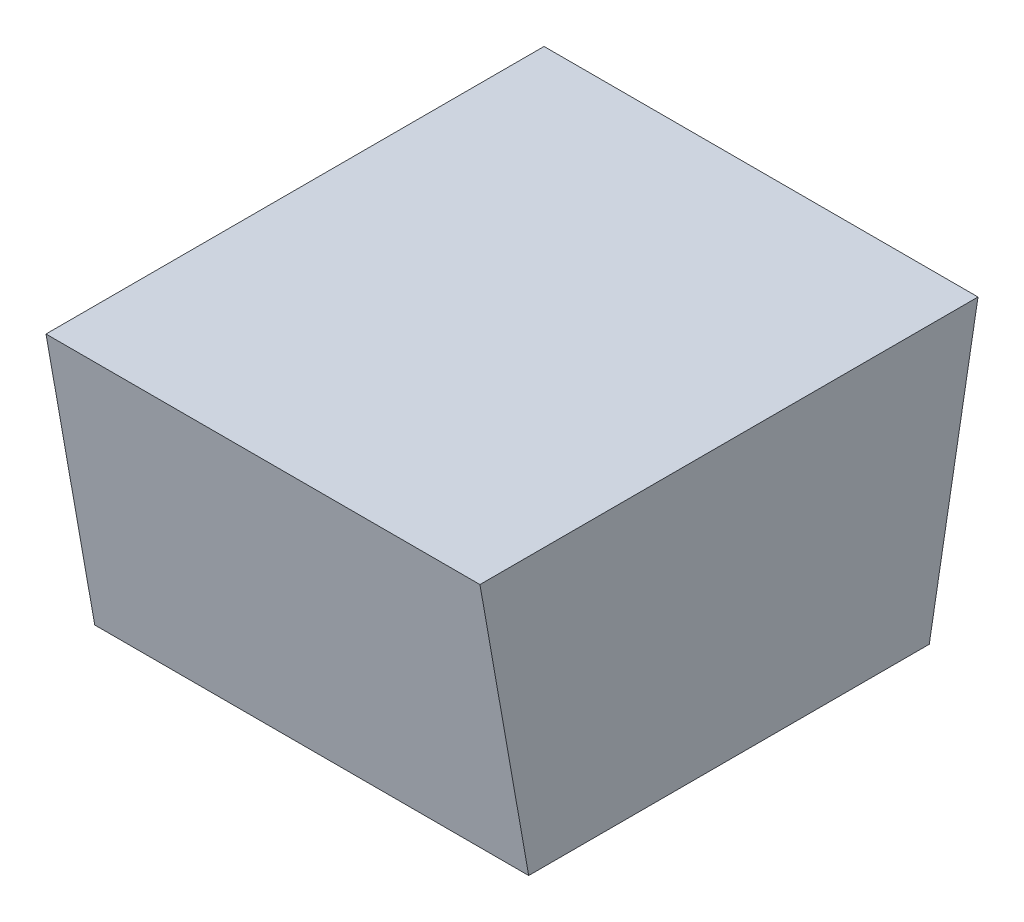
from build123d import *

# Parameters (mm, degrees)
SKETCH_TL_CUTTING_R    = 1.498500051
TL_CUTTING_DEPTH       = 29.999999944
SKETCH_TDF_CUTTING_W   = 3.017000062
SKETCH_TDF_CUTTING_H   = 3.017000062
TDF_CUTTING_DEPTH      = 31.074756881
VW_VR_GRINDING_DEPTH   = 1.508500031
VW_VR_GRINDING_2_DEPTH = 1.508500031
ISA_GRINDING_DEPTH     = 1.508500031
SKETCH_PRE_FRX_BRX_W   = 1.16299996
SKETCH_PRE_FRX_BRX_H   = 0.889999998
SKETCH_PRE_FRX_BRX_W_2 = 1.194000152
PRE_FRX_BRX_DEPTH      = 1.508500031
FA_BA_GRINDING_DEPTH   = 1.508500031


with BuildPart() as part:
    # sketch_TL_cutting → TL_cutting (new body)
    with BuildSketch(Plane(origin=(0, 0, 0), x_dir=(1, 0, 0), z_dir=(0, 1, 0))):
        with Locations(Location((0, 0, 0), (0, 0, 270))):
            Circle(SKETCH_TL_CUTTING_R)
    extrude(amount=TL_CUTTING_DEPTH)

    # sketch_TDF_cutting → TDF_cutting (cut, through all)
    with BuildSketch(Plane(origin=(0, 0, 0), x_dir=(1, 0, 0), z_dir=(0, 1, 0))):
        with Locations((-2.709999914, 0)):
            Rectangle(SKETCH_TDF_CUTTING_W, SKETCH_TDF_CUTTING_H)
    extrude(amount=TDF_CUTTING_DEPTH, mode=Mode.SUBTRACT)


with BuildPart() as body_2:
    # sketch_VW_VR_grinding → VW_VR_grinding (new, symmetric)
    with BuildSketch(Plane(origin=(0, 0, 0), x_dir=(0, 0, -1), z_dir=(1, 0, 0))):
        with BuildLine():
            Line((-1.493500061, -0.00999998), (-1.493500061, 0.878888912))
            ThreePointArc((-1.493500061, 0.878888912), (-1.493548388, 0.87999579), (-1.493693003, 0.881094244))
            Line((-1.493693003, 0.881094244), (-1.518500011, 1.02178178))
            Line((-1.518500011, 1.02178178), (-1.508500031, -0.00999998))
            Line((-1.508500031, -0.00999998), (-1.493500061, -0.00999998))
        make_face()
    extrude(amount=VW_VR_GRINDING_DEPTH, both=True)


with BuildPart() as body_3:
    # sketch_VW_VR_grinding → VW_VR_grinding 2 (new, symmetric)
    with BuildSketch(Plane(origin=(0, 0, 0), x_dir=(0, 0, -1), z_dir=(1, 0, 0))):
        with BuildLine():
            Line((1.493500061, -0.00999998), (1.493500061, 0.878888912))
            ThreePointArc((1.493500061, 0.878888912), (1.493548388, 0.87999579), (1.493693003, 0.881094244))
            Line((1.493693003, 0.881094244), (1.518500011, 1.02178178))
            Line((1.518500011, 1.02178178), (1.508500031, -0.00999998))
            Line((1.508500031, -0.00999998), (1.493500061, -0.00999998))
        make_face()
    extrude(amount=VW_VR_GRINDING_2_DEPTH, both=True)


    add(body_2.part)  # ISA_grinding merges body 2
    # sketch_ISA_grinding → ISA_grinding (add, symmetric)
    with BuildSketch(Plane(origin=(0, 0, 0), x_dir=(0, 0, -1), z_dir=(1, 0, 0))):
        Polygon((-0.300000035, 0), (0.300000035, 0), (1.508500031, 6.853744056), (1.508500031, -0.02999994), (-1.508500031, -0.02999994), (-1.508500031, 6.853744056), align=None)
    extrude(amount=ISA_GRINDING_DEPTH, both=True)

    # sketch_pre_FRX_BRX → pre_FRX_BRX (add, symmetric)
    with BuildSketch(Plane.XY):
        with Locations((0.917000071, 0.435000019)):
            Rectangle(SKETCH_PRE_FRX_BRX_W, SKETCH_PRE_FRX_BRX_H)
        with Locations((-0.921499935, 0.435000019)):
            Rectangle(SKETCH_PRE_FRX_BRX_W_2, SKETCH_PRE_FRX_BRX_H)
    extrude(amount=PRE_FRX_BRX_DEPTH, both=True)

    # sketch_FA_BA_grinding → FA_BA_grinding (add, symmetric)
    with BuildSketch(Plane.XY):
        Polygon((0.325500111, -0.00999998), (0.325500111, 0.889999998), (1.625500051, 10.13998021), (1.625500051, -0.00999998), align=None)
        Polygon((-0.324499859, -0.00999998), (-0.324499859, 0.889999998), (-1.328499883, 8.03383137), (-1.328499883, -0.00999998), align=None)
    extrude(amount=FA_BA_GRINDING_DEPTH, both=True)


with BuildPart() as part_1:
    add(part.part)

    # B1_fix: cut body 3
    add(body_3.part, mode=Mode.SUBTRACT)

    # SurfaceCut1
    split(bisect_by=Plane(origin=(0, 0.41401793, 0), x_dir=(1, 0, 0), z_dir=(0, 1, 0)), keep=Keep.BOTTOM)


solid = part_1.part
